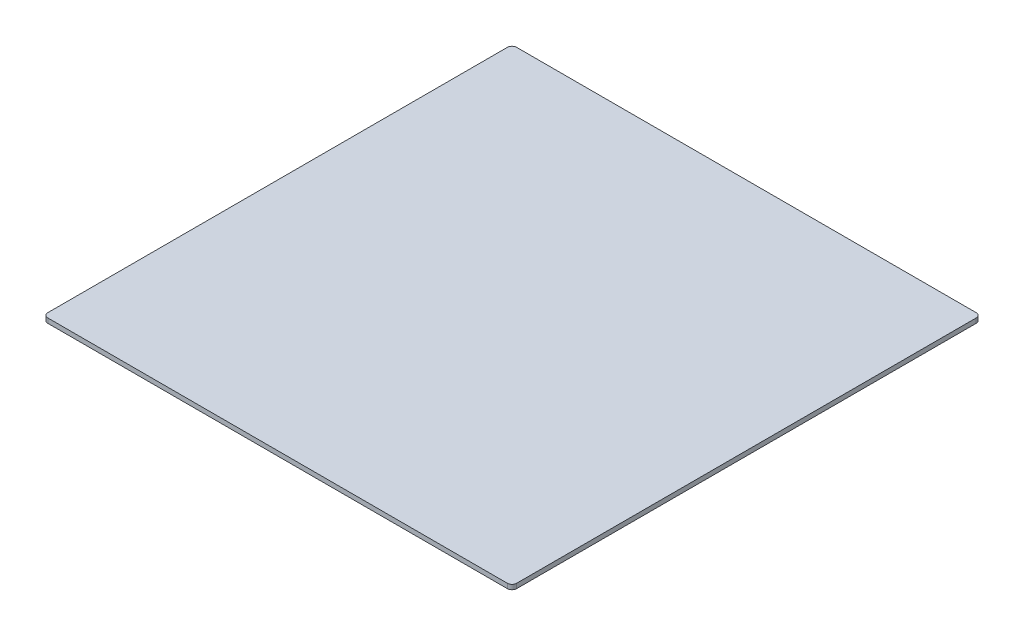
from build123d import *

# Parameters (mm, degrees)
RESSALTO_EXTRUS_O1_DEPTH = 1


with BuildPart() as part:
    # Esboço1 → Ressalto-extrusão1 (new body)
    with BuildSketch(Plane(origin=(0, 0, 0), x_dir=(1, 0, 0), z_dir=(0, 1, 0))):
        with BuildLine():
            Line((-39.8050781, 119.445393854), (58.1949219, 119.445393854))
            ThreePointArc((58.1949219, 119.445393854), (58.902028682, 119.152500635), (59.1949219, 118.445393854))
            Line((59.1949219, 118.445393854), (59.1949219, 20.445393854))
            ThreePointArc((59.1949219, 20.445393854), (58.902028682, 19.738287073), (58.1949219, 19.445393854))
            Line((58.1949219, 19.445393854), (-39.8050781, 19.445393854))
            ThreePointArc((-39.8050781, 19.445393854), (-40.512184881, 19.738287073), (-40.8050781, 20.445393854))
            Line((-40.8050781, 20.445393854), (-40.8050781, 118.445393854))
            ThreePointArc((-40.8050781, 118.445393854), (-40.512184881, 119.152500635), (-39.8050781, 119.445393854))
        make_face()
    extrude(amount=RESSALTO_EXTRUS_O1_DEPTH)


solid = part.part
